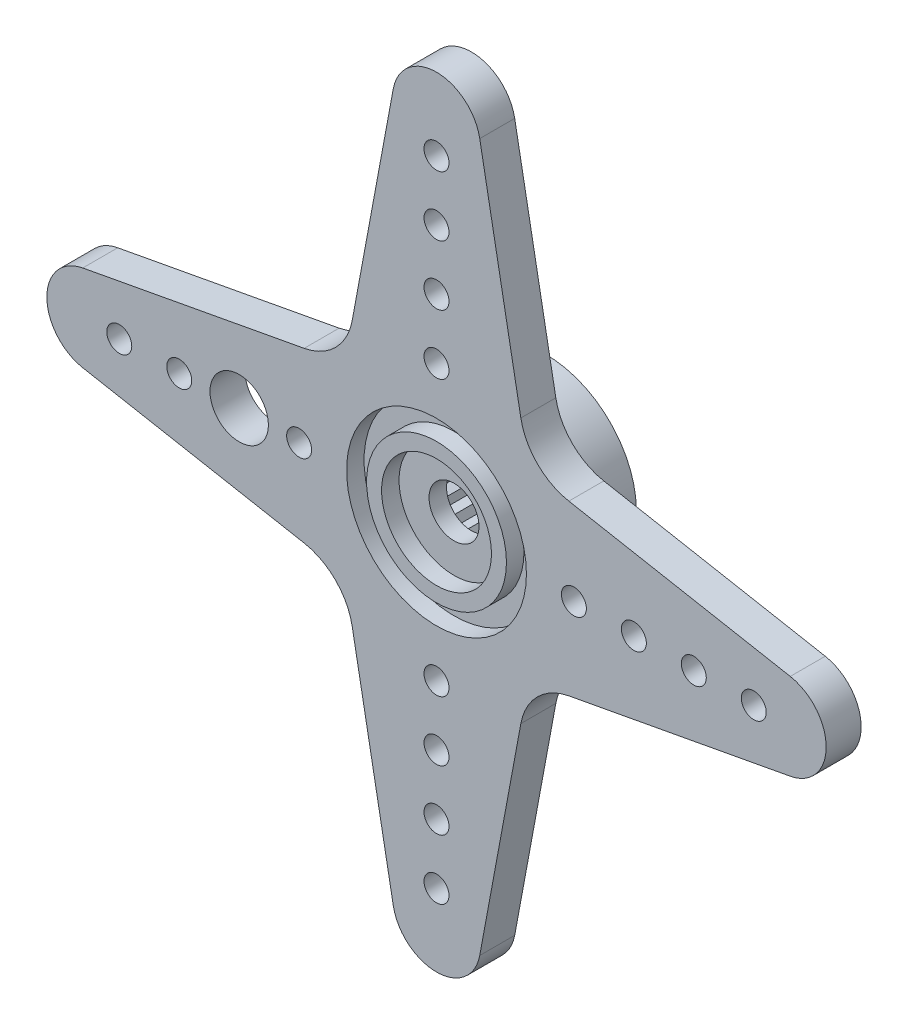
from build123d import *

# Parameters (mm, degrees)
SKETCH1_R           = 4.5000037
BOSS_EXTRUDE1_DEPTH = 3.75000012
BOSS_EXTRUDE2_START = 1.750000056
SKETCH2_R           = 4.5000037
SKETCH2_R_2         = 3.499999998
SKETCH2_R_3         = 1.25000004
BOSS_EXTRUDE2_DEPTH = 1.750000056
SKETCH4_R           = 2.75000466
SKETCH4_R_2         = 1.25000004
CUT_EXTRUDE1_DEPTH  = 0.875000028
SKETCH6_R           = 4.5000037
SKETCH6_R_2         = 3.5000057
CUT_EXTRUDE2_DEPTH  = 0.875000028
SKETCH10_R          = 0.62500002
SKETCH10_R_2        = 4.5000037
BOSS_EXTRUDE4_DEPTH = 1.750000056
CHAMFER2_SIZE       = 1.00000054
CHAMFER2_SIZE2      = 0.577350581
SKETCH32_R          = 1.4605
CUT_EXTRUDE8_DEPTH  = 36.768264294


with BuildPart() as part:
    # Sketch1 → Boss-Extrude1 (new body)
    with BuildSketch(Plane.XY):
        with Locations((-10.24995918, 0)):
            Circle(SKETCH1_R)
        Polygon((-10.24995918, 2.999994), (-10.594624819, 2.728309468), (-10.996027349, 2.905743672), (-11.262299488, 2.55687975), (-11.695217312, 2.628914782), (-11.866365092, 2.224791874), (-12.303596391, 2.186901508), (-12.368865968, 1.752912142), (-12.782937891, 1.60747717), (-12.738228138, 1.170890494), (-13.103123023, 0.927049129), (-12.951243218, 0.515297489), (-13.244033377, 0.188371182), (-12.994526687, -0.172673551), (-13.196815038, -0.562142819), (-12.865358886, -0.849794878), (-12.964434908, -1.27733532), (-12.571855902, -1.473520467), (-12.561494285, -1.912268145), (-12.132459609, -2.004659346), (-12.01331141, -2.427046129), (-11.574778889, -2.409838105), (-11.354330629, -2.789323879), (-10.933854876, -2.663597874), (-10.625958129, -2.976338151), (-10.24995918, -2.749993992), (-9.873960231, -2.976338151), (-9.566063484, -2.663597874), (-9.145587731, -2.789323879), (-8.925139471, -2.409838105), (-8.48660695, -2.427046129), (-8.367458751, -2.004659346), (-7.938424075, -1.912268145), (-7.928062458, -1.473520467), (-7.535483452, -1.27733532), (-7.634559474, -0.849794878), (-7.303103322, -0.562142819), (-7.505391673, -0.172673551), (-7.255884983, 0.188371182), (-7.548675142, 0.515297489), (-7.396795337, 0.927049129), (-7.761690222, 1.170890494), (-7.716980469, 1.60747717), (-8.131052392, 1.752912142), (-8.196321969, 2.186901508), (-8.633553268, 2.224791874), (-8.804701048, 2.628914782), (-9.237618872, 2.55687975), (-9.503891011, 2.905743672), (-9.905293541, 2.728309468), align=None, mode=Mode.SUBTRACT)
    extrude(amount=-BOSS_EXTRUDE1_DEPTH)

    # Sketch2 → Boss-Extrude2 (add)
    # profile 1 of 2: a face of its own
    with BuildSketch(Plane.XY.offset(BOSS_EXTRUDE2_START)):
        with Locations((-10.24995918, 0)):
            Circle(SKETCH2_R)
        with Locations((-10.24995918, 0)):
            Circle(SKETCH2_R_2, mode=Mode.SUBTRACT)
    # profile 2 of 2: a face of its own
    with BuildSketch(Plane.XY.offset(BOSS_EXTRUDE2_START)):
        with Locations((-10.24995918, 0)):
            Circle(SKETCH2_R_2)
        with Locations((-10.24995918, 0)):
            Circle(SKETCH2_R_3, mode=Mode.SUBTRACT)
    extrude(amount=-BOSS_EXTRUDE2_DEPTH)

    # Sketch4 → Cut-Extrude1 (cut)
    with BuildSketch(Plane.XY.offset(1.750000056)):
        with Locations((-10.24995918, 0)):
            Circle(SKETCH4_R)
        with Locations((-10.24995918, 0)):
            Circle(SKETCH4_R_2, mode=Mode.SUBTRACT)
    extrude(amount=-CUT_EXTRUDE1_DEPTH, mode=Mode.SUBTRACT)

    # Sketch6 → Cut-Extrude2 (cut)
    with BuildSketch(Plane.XY.offset(1.750000056)):
        with Locations((-10.24995918, 0)):
            Circle(SKETCH6_R)
        with Locations((-10.24995918, 0)):
            Circle(SKETCH6_R_2, mode=Mode.SUBTRACT)
    extrude(amount=-CUT_EXTRUDE2_DEPTH, mode=Mode.SUBTRACT)

    # Sketch10 → Boss-Extrude4 (add)
    with BuildSketch(Plane.XY.offset(1.750000056)):
        with BuildLine():
            Line((-8.086927824, 17.701557226), (-6.029886341, 6.622035833))
            ThreePointArc((-6.029886341, 6.622035833), (-5.20161423, 5.04834495), (-3.627923347, 4.220072839))
            Line((-3.627923347, 4.220072839), (7.451598046, 2.163031356))
            ThreePointArc((7.451598046, 2.163031356), (9.25000182, 0), (7.451598046, -2.163031356))
            Line((7.451598046, -2.163031356), (-3.627923347, -4.220072839))
            ThreePointArc((-3.627923347, -4.220072839), (-5.20161423, -5.04834495), (-6.029886341, -6.622035833))
            Line((-6.029886341, -6.622035833), (-8.086927824, -17.701557226))
            ThreePointArc((-8.086927824, -17.701557226), (-10.24995918, -19.499961), (-12.412990536, -17.701557226))
            Line((-12.412990536, -17.701557226), (-14.470032019, -6.622035833))
            ThreePointArc((-14.470032019, -6.622035833), (-15.29830413, -5.04834495), (-16.871995013, -4.220072839))
            Line((-16.871995013, -4.220072839), (-27.951516406, -2.163031356))
            ThreePointArc((-27.951516406, -2.163031356), (-29.74992018, 0), (-27.951516406, 2.163031356))
            Line((-27.951516406, 2.163031356), (-16.871995013, 4.220072839))
            ThreePointArc((-16.871995013, 4.220072839), (-15.29830413, 5.04834495), (-14.470032019, 6.622035833))
            Line((-14.470032019, 6.622035833), (-12.412990536, 17.701557226))
            ThreePointArc((-12.412990536, 17.701557226), (-10.24995918, 19.499961), (-8.086927824, 17.701557226))
        make_face()
        with Locations((-10.24995918, 15.87496698)):
            Circle(SKETCH10_R, mode=Mode.SUBTRACT)
        with Locations((-10.24995918, 12.87497298)):
            Circle(SKETCH10_R, mode=Mode.SUBTRACT)
        with Locations((-10.24995918, 9.87497898)):
            Circle(SKETCH10_R, mode=Mode.SUBTRACT)
        with Locations((-10.24995918, 6.87498498)):
            Circle(SKETCH10_R, mode=Mode.SUBTRACT)
        with Locations((5.6250078, 0)):
            Circle(SKETCH10_R, mode=Mode.SUBTRACT)
        with Locations((2.6250138, 0)):
            Circle(SKETCH10_R, mode=Mode.SUBTRACT)
        with Locations((-0.3749802, 0)):
            Circle(SKETCH10_R, mode=Mode.SUBTRACT)
        with Locations((-3.3749742, 0)):
            Circle(SKETCH10_R, mode=Mode.SUBTRACT)
        with Locations((-10.24995918, -15.87496698)):
            Circle(SKETCH10_R, mode=Mode.SUBTRACT)
        with Locations((-10.24995918, -12.87497298)):
            Circle(SKETCH10_R, mode=Mode.SUBTRACT)
        with Locations((-10.24995918, -9.87497898)):
            Circle(SKETCH10_R, mode=Mode.SUBTRACT)
        with Locations((-10.24995918, -6.87498498)):
            Circle(SKETCH10_R, mode=Mode.SUBTRACT)
        with Locations((-26.12492616, 0)):
            Circle(SKETCH10_R, mode=Mode.SUBTRACT)
        with Locations((-23.12493216, 0)):
            Circle(SKETCH10_R, mode=Mode.SUBTRACT)
        with Locations((-20.12493816, 0)):
            Circle(SKETCH10_R, mode=Mode.SUBTRACT)
        with Locations((-17.12494416, 0)):
            Circle(SKETCH10_R, mode=Mode.SUBTRACT)
        with Locations((-10.24995918, 0)):
            Circle(SKETCH10_R_2, mode=Mode.SUBTRACT)
    extrude(amount=-BOSS_EXTRUDE4_DEPTH)

    # Chamfer2
    chamfer2_edges = [part.edges().sort_by_distance(p)[0] for p in [
        (-14.74996288, 0, 0),
    ]]
    chamfer2_side = [part.faces().sort_by_distance(p)[0] for p in [
        (-14.74996288, 0, -1.87500006),
    ]]
    chamfer(chamfer2_edges, length=CHAMFER2_SIZE, length2=CHAMFER2_SIZE2, reference=chamfer2_side[0])

    # Sketch32 → Cut-Extrude8 (cut, through all)
    with BuildSketch(Plane(origin=(0, 0, 0), x_dir=(-1, 0, 0), z_dir=(0, 0, -1))):
        with Locations((20.12493816, 0)):
            Circle(SKETCH32_R)
    extrude(amount=-CUT_EXTRUDE8_DEPTH, mode=Mode.SUBTRACT)


solid = part.part
